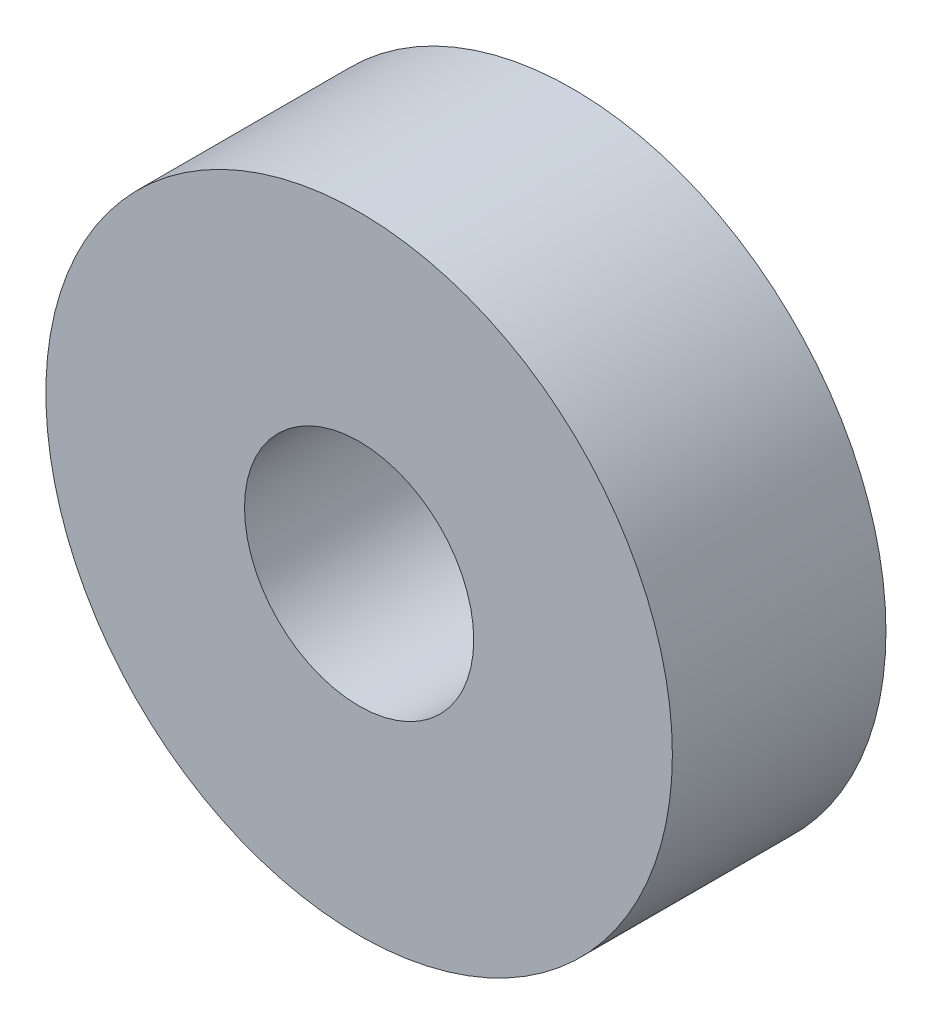
from build123d import *

# Parameters (mm, degrees)
SKETCH1_R           = 22
BOSS_EXTRUDE1_DEPTH = 15
SKETCH2_R           = 17.85
SKETCH2_R_2         = 12.5
CUT_EXTRUDE1_DEPTH  = 10
SKETCH3_R           = 8.05
CUT_EXTRUDE2_DEPTH  = 35.539832078


with BuildPart() as part:
    # Sketch1 → Boss-Extrude1 (new body)
    with BuildSketch(Plane.XY):
        Circle(SKETCH1_R)
    extrude(amount=BOSS_EXTRUDE1_DEPTH)

    # Sketch2 → Cut-Extrude1 (cut)
    with BuildSketch(Plane(origin=(0, 0, 0), x_dir=(-1, 0, 0), z_dir=(0, 0, -1))):
        Circle(SKETCH2_R)
        Circle(SKETCH2_R_2, mode=Mode.SUBTRACT)
    extrude(amount=-CUT_EXTRUDE1_DEPTH, mode=Mode.SUBTRACT)

    # Sketch3 → Cut-Extrude2 (cut, through all)
    with BuildSketch(Plane.XY.offset(15)):
        Circle(SKETCH3_R)
    extrude(amount=-CUT_EXTRUDE2_DEPTH, mode=Mode.SUBTRACT)


solid = part.part
